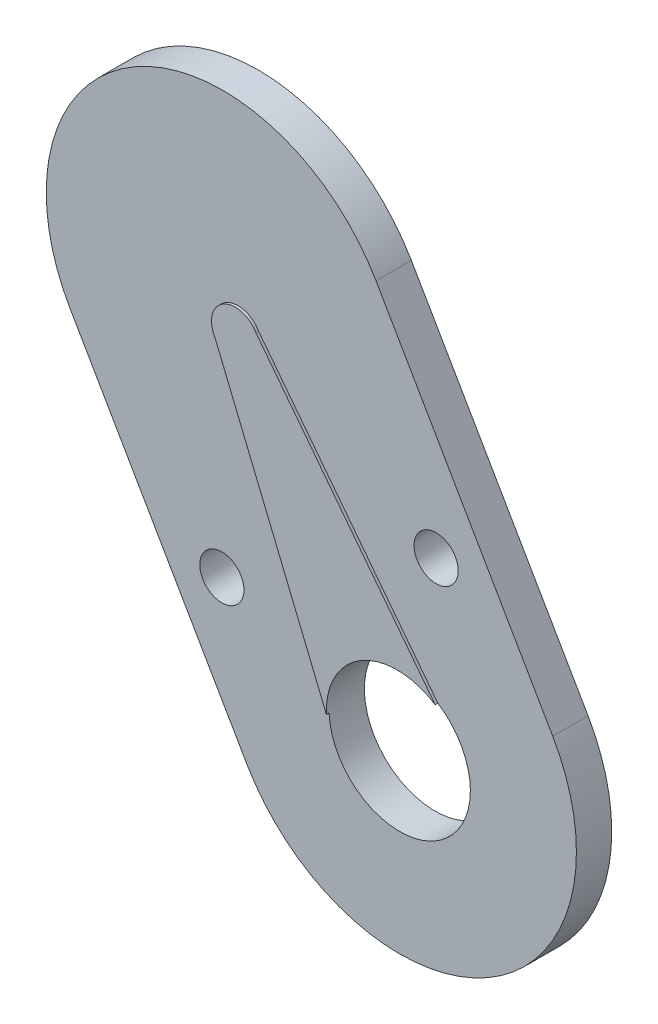
from build123d import *

# Parameters (mm, degrees)
RETAINER_PLATE_2MM_START         = -2
RETAINER_PLATE_2MM_DEPTH         = 2
RETAINER_PLATE_2MM_ROOT_START    = -2
SKETCH_2_R                       = 10
RETAINER_PLATE_2MM_ROOT_DEPTH    = 2
RETAINER_PLATE_2MM_TIP_START     = -2
SKETCH_3_R                       = 10
RETAINER_PLATE_2MM_TIP_DEPTH     = 2
HORN_CONTACT_PAD_0P15_DEPTH      = 0.15
SKETCH_5_R                       = 3.8
HORN_CONTACT_PAD_0P15_ROOT_DEPTH = 0.15
SKETCH_6_R                       = 1.35
HORN_CONTACT_PAD_0P15_TIP_DEPTH  = 0.15
BOSS_CLEARANCE_8_START           = -2.1
SKETCH_7_R                       = 4
BOSS_CLEARANCE_8_DEPTH           = 2.5
M2_CLEARANCE_2P5_PITCH14_START   = -2.1
SKETCH_8_R                       = 1.25
M2_CLEARANCE_2P5_PITCH14_DEPTH   = 2.5


with BuildPart() as part:
    # 草图1 → Retainer_plate_2mm (new body)
    with BuildSketch(Plane.XY.offset(RETAINER_PLATE_2MM_START)):
        Polygon((8.660254038, 5), (-1.339745962, 22.320508076), (-18.660254038, 12.320508076), (-8.660254038, -5), align=None)
    extrude(amount=RETAINER_PLATE_2MM_DEPTH)

    # 草图2 → Retainer_plate_2mm_root (add)
    with BuildSketch(Plane.XY.offset(RETAINER_PLATE_2MM_ROOT_START)):
        Circle(SKETCH_2_R)
    extrude(amount=RETAINER_PLATE_2MM_ROOT_DEPTH)

    # 草图3 → Retainer_plate_2mm_tip (add)
    with BuildSketch(Plane.XY.offset(RETAINER_PLATE_2MM_TIP_START)):
        with Locations((-10, 17.320508076)):
            Circle(SKETCH_3_R)
    extrude(amount=RETAINER_PLATE_2MM_TIP_DEPTH)

    # 草图4 → Horn_contact_pad_0p15 (add)
    with BuildSketch(Plane.XY):
        Polygon((3.290896534, 1.9), (-7.980865705, 16.523264889), (-10.319134295, 15.173264889), (-3.290896534, -1.9), align=None)
    extrude(amount=HORN_CONTACT_PAD_0P15_DEPTH)

    # 草图5 → Horn_contact_pad_0p15_root (add)
    with BuildSketch(Plane.XY):
        Circle(SKETCH_5_R)
    extrude(amount=HORN_CONTACT_PAD_0P15_ROOT_DEPTH)

    # 草图6 → Horn_contact_pad_0p15_tip (add)
    with BuildSketch(Plane.XY):
        with Locations((-9.15, 15.848264889)):
            Circle(SKETCH_6_R)
    extrude(amount=HORN_CONTACT_PAD_0P15_TIP_DEPTH)

    # 草图7 → Boss_clearance_8 (cut)
    with BuildSketch(Plane.XY.offset(BOSS_CLEARANCE_8_START)):
        with Locations(Location((0, 0, 0), (0, 0, 182.696435406))):
            Circle(SKETCH_7_R)
    extrude(amount=BOSS_CLEARANCE_8_DEPTH, mode=Mode.SUBTRACT)

    # 草图8 → M2_clearance_2p5_pitch14 (cut)
    with BuildSketch(Plane.XY.offset(M2_CLEARANCE_2P5_PITCH14_START)):
        with Locations((2.062177826, 10.42820323)):
            Circle(SKETCH_8_R)
        with Locations((-10.062177826, 3.42820323)):
            Circle(SKETCH_8_R)
    extrude(amount=M2_CLEARANCE_2P5_PITCH14_DEPTH, mode=Mode.SUBTRACT)


solid = part.part
